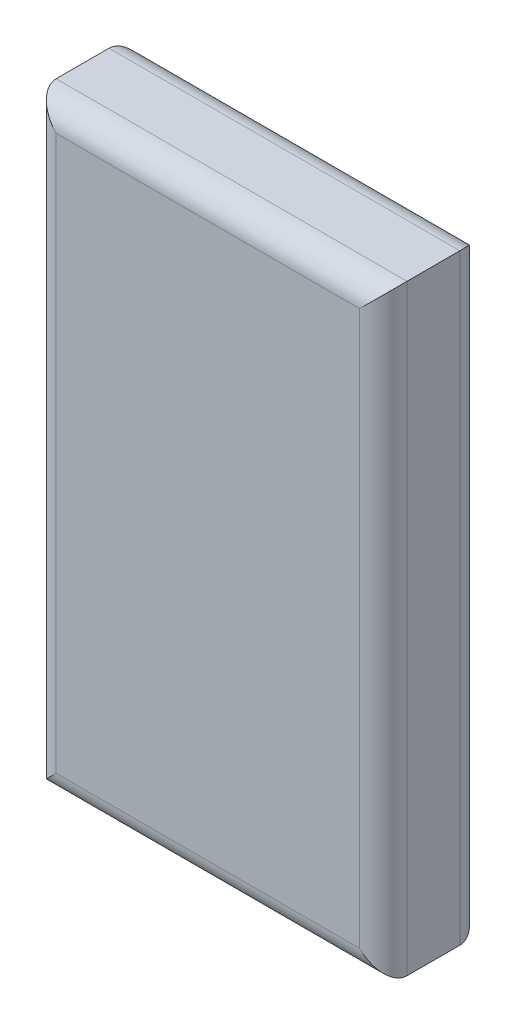
from build123d import *

# Parameters (mm, degrees)
SKETCH1_W           = 22.225
SKETCH1_H           = 38.1
BOSS_EXTRUDE1_DEPTH = 6.35
FILLET1_R           = 1.5


with BuildPart() as part:
    # Sketch1 → Boss-Extrude1 (new body)
    with BuildSketch(Plane.XY):
        Rectangle(SKETCH1_W, SKETCH1_H)
    extrude(amount=BOSS_EXTRUDE1_DEPTH)

    # Fillet1
    fillet1_edges = [part.edges().sort_by_distance(p)[0] for p in [
        (-11.1125, 0, 6.35),
        (0, -19.05, 6.35),
        (11.1125, 0, 6.35),
        (0, -19.05, 0),
        (-11.1125, 0, 0),
        (0, 19.05, 0),
        (11.1125, 0, 0),
        (0, 19.05, 6.35),
    ]]
    fillet(fillet1_edges, radius=FILLET1_R)


solid = part.part
